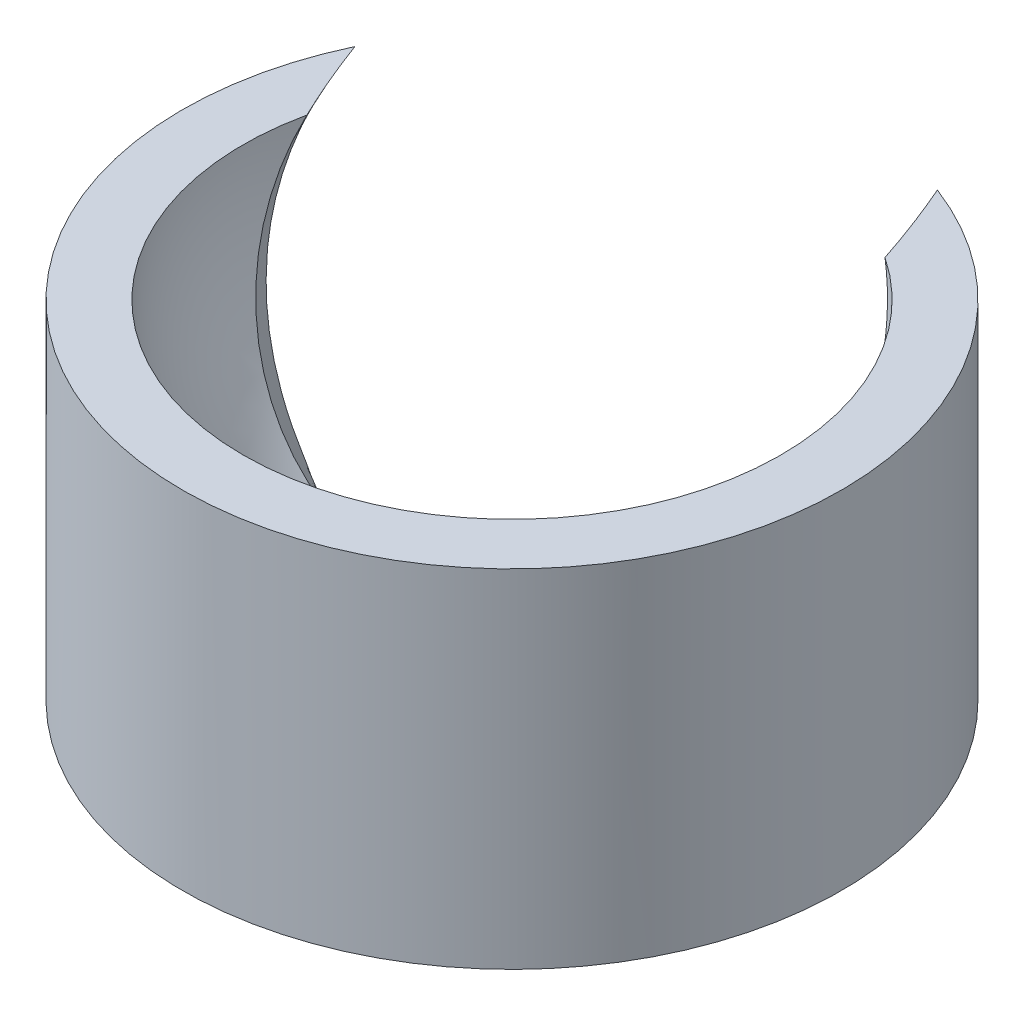
from build123d import *

# Parameters (mm, degrees)
KEYED_BACK_DEPTH   = 0.7
CUP_BLANK_SKETCH_R = 3.8
CUP_BLANK_DEPTH    = 3.3


with BuildPart() as part:
    # Keyed Back Sketch → Keyed Back (new body)
    with BuildSketch(Plane(origin=(0, -97, 0), x_dir=(-1, 0, 0), z_dir=(0, -1, 0))):
        with BuildLine():
            Line((59.811552234, -28.568114168), (55.771750258, -26.23573341))
            ThreePointArc((55.771750258, -26.23573341), (54.391651246, -33.290896534), (59.811552234, -28.568114168))
        make_face()
    extrude(amount=KEYED_BACK_DEPTH)

    # Cup Blank Sketch → Cup Blank (add)
    with BuildSketch(Plane(origin=(0, -97.7, 0), x_dir=(-1, 0, 0), z_dir=(0, -1, 0))):
        with Locations(Location((56.291651246, -30, 0), (0, 0, 22.136353638))):
            Circle(CUP_BLANK_SKETCH_R)
    extrude(amount=CUP_BLANK_DEPTH)

    # Spherical Bearing Seat profile → Spherical Bearing Seat (revolve, cut)
    with BuildSketch(Plane(origin=(0, -101, 0), x_dir=(-1, 0, 0), z_dir=(0, -1, 0))):
        with BuildLine():
            Line((56.291651246, -33.1), (56.291651246, -26.9))
            ThreePointArc((56.291651246, -26.9), (53.191651246, -30), (56.291651246, -33.1))
        make_face()
    revolve(axis=Axis((-56.291651246, -101, 20), (0, 0, 1)), mode=Mode.SUBTRACT)

    # Articulation Throat Sketch → Articulation Throat (revolve, cut)
    with BuildSketch(Plane(origin=(-75.19414337, -14.119516346, 20.509419779), x_dir=(-0.2544785459472912, -0.04778449262394895, -0.9658971539026421), z_dir=(0.9493062747008634, 0.178255178692775, -0.2589260282064664))):
        Polygon((-9.825663304, -88.876600419), (-8.475389129, -90.738524062), (14.088996194, -82.675837476), (8.793573125, -75.373858667), align=None)
    revolve(axis=Axis((-53.148124615, -106.383086561, 37.819246728), (-0.3143526631246646, 0.5383086561091633, -0.781924672807028)), mode=Mode.SUBTRACT)


with BuildPart() as body_2:
    # Mirror1: mirrored copy
    add(part.part.mirror(Plane(origin=(0, 0, 0), x_dir=(0, 0, 1), z_dir=(0, -1, 0))))


solid = body_2.part
